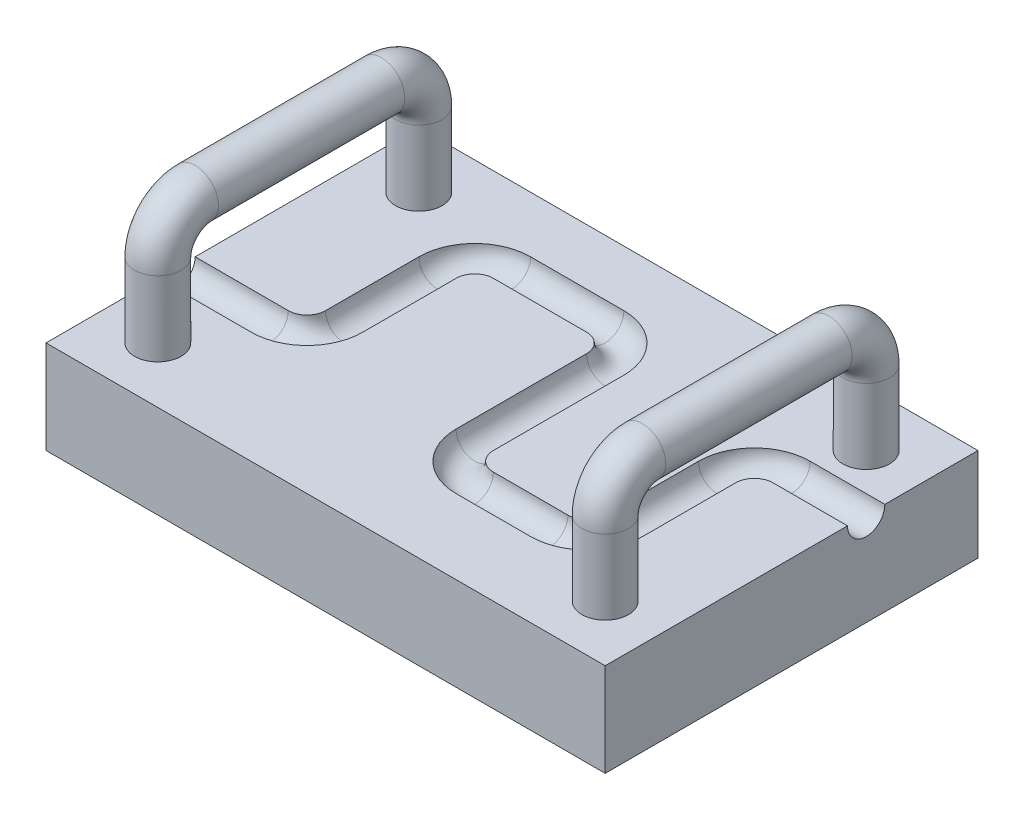
from build123d import *

# Parameters (mm, degrees)
SKETCH1_W            = 300
SKETCH1_H            = 200
BOSS_EXTRUDE1_DEPTH  = 50
CUT_SWEEP1_PROFILE_R = 10
SKETCH14_R           = 12.5


with BuildPart() as part:
    # Sketch1 → Boss-Extrude1 (new body)
    with BuildSketch(Plane(origin=(0, 0, 0), x_dir=(1, 0, 0), z_dir=(0, 1, 0))):
        Rectangle(SKETCH1_W, SKETCH1_H)
    extrude(amount=BOSS_EXTRUDE1_DEPTH)

    # Cut-Sweep1: sweep along a path in Sketch2
    with BuildLine(Plane(origin=(0, 50, 0), x_dir=(1, 0, 0), z_dir=(0, 1, 0))) as cut_sweep1_path:
        Line((150, 40), (110, 40))
        ThreePointArc((110, 40), (95.857864376, 34.142135624), (90, 20))
        Line((90, 20), (90, -30))
        ThreePointArc((90, -30), (84.142135624, -44.142135624), (70, -50))
        Line((70, -50), (30, -50))
        ThreePointArc((30, -50), (15.857864376, -44.142135624), (10, -30))
        Line((10, -30), (10, 40))
        ThreePointArc((10, 40), (4.142135624, 54.142135624), (-10, 60))
        Line((-10, 60), (-60, 60))
        ThreePointArc((-60, 60), (-74.142135624, 54.142135624), (-80, 40))
        Line((-80, 40), (-80, -10))
        ThreePointArc((-80, -10), (-85.857864376, -24.142135624), (-100, -30))
        Line((-100, -30), (-150, -30))
    # Cut-Sweep1 profile (on start of the path) → Cut-Sweep1 (sweep, cut)
    with BuildSketch(Plane(origin=(150, 50, -40), x_dir=(0, 0, -1), z_dir=(-1, 0, 0))):
        Circle(CUT_SWEEP1_PROFILE_R)
    sweep(path=cut_sweep1_path.line, mode=Mode.SUBTRACT)

    # Sweep1: sweep along a curve in space
    with BuildLine() as sweep1_path:
        Line((-120, 50, -70), (-120, 90, -70))
        ThreePointArc((-120, 90, -70), (-120, 104.142135624, -64.142135624), (-120, 110, -50))
        Line((-120, 110, -50), (-120, 110, 50))
        ThreePointArc((-120, 110, 50), (-120, 104.142135624, 64.142135624), (-120, 90, 70))
        Line((-120, 90, 70), (-120, 50, 70))
    # Sketch14 → Sweep1 (sweep)
    with BuildSketch(Plane(origin=(0, 50, 0), x_dir=(1, 0, 0), z_dir=(0, 1, 0))):
        with Locations((-120, 70)):
            Circle(SKETCH14_R)
    sweep1 = sweep(path=sweep1_path.line)

    # Mirror1: Sweep1 across plane
    add(sweep1.mirror(Plane(origin=(0, 0, 0), x_dir=(0, 0, 1), z_dir=(1, 0, 0))))


solid = part.part
